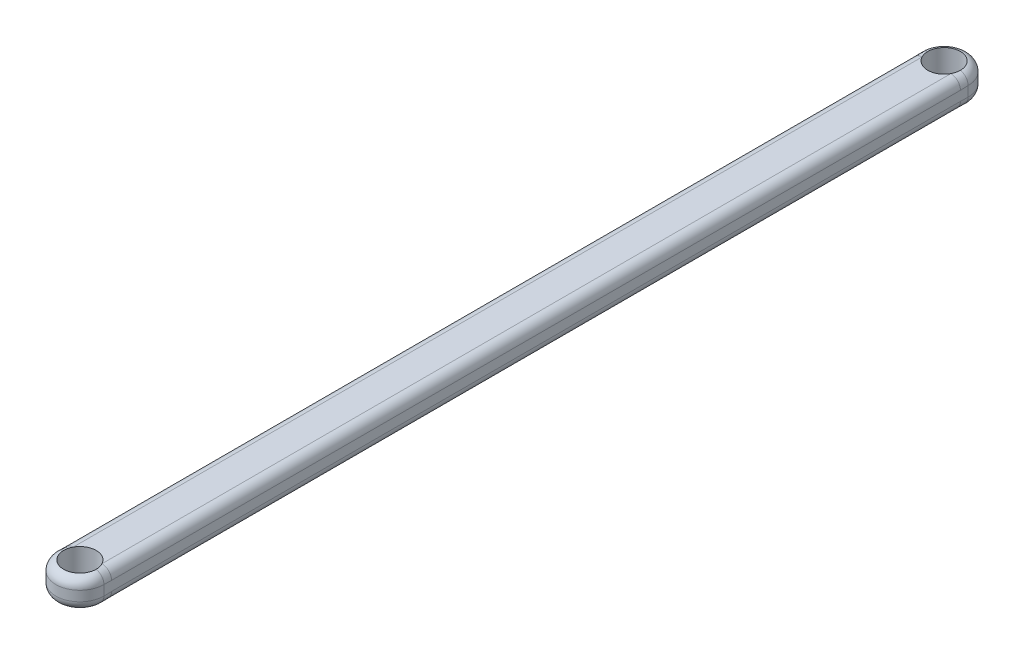
from build123d import *

# Parameters (mm, degrees)
EXTRUDE_1_DEPTH     = 3
CUT_EXTRUDE_1_REACH = 94.582
SKETCH_2_R          = 1.7
FILLET_1_R          = 1


with BuildPart() as part:
    # 草图1 → 凸台-拉伸1 (new body)
    with BuildSketch(Plane(origin=(0, 0, 0), x_dir=(1, 0, 0), z_dir=(0, 1, 0))):
        with BuildLine():
            Line((2.5, 0), (2.5, 90))
            ThreePointArc((2.5, 90), (0, 92.5), (-2.5, 90))
            Line((-2.5, 90), (-2.5, 0))
            ThreePointArc((-2.5, 0), (0, -2.5), (2.5, 0))
        make_face()
    extrude(amount=EXTRUDE_1_DEPTH)

    # 草图2 → 切除-拉伸1 (cut, up to next)
    with BuildSketch(Plane(origin=(0, 3, 0), x_dir=(1, 0, 0), z_dir=(0, 1, 0)), mode=Mode.PRIVATE) as cut_extrude_1_sk1:
        with Locations(Location((0, 0, 0), (0, 0, 270))):
            Circle(SKETCH_2_R)
    cut_extrude_1_tool1 = extrude(cut_extrude_1_sk1.sketch, amount=-CUT_EXTRUDE_1_REACH, mode=Mode.PRIVATE) & part.part
    # 草图2 → 切除-拉伸1 (cut, up to next)
    with BuildSketch(Plane(origin=(0, 3, 0), x_dir=(1, 0, 0), z_dir=(0, 1, 0)), mode=Mode.PRIVATE) as cut_extrude_1_sk2:
        with Locations(Location((0, 90, 0), (0, 0, 270))):
            Circle(SKETCH_2_R)
    cut_extrude_1_tool2 = extrude(cut_extrude_1_sk2.sketch, amount=-CUT_EXTRUDE_1_REACH, mode=Mode.PRIVATE) & part.part
    add(cut_extrude_1_tool1.solids().sort_by_distance((0, 3, 0))[0], mode=Mode.SUBTRACT)
    add(cut_extrude_1_tool2.solids().sort_by_distance((0, 3, -90))[0], mode=Mode.SUBTRACT)

    # 圆角1
    fillet_1_edges = [part.edges().sort_by_distance(p)[0] for p in [
        (-2.5, 0, -45),
        (-2.5, 3, -45),
        (2.5, 0, -45),
        (2.5, 3, -45),
    ]]
    fillet(fillet_1_edges, radius=FILLET_1_R)


solid = part.part
